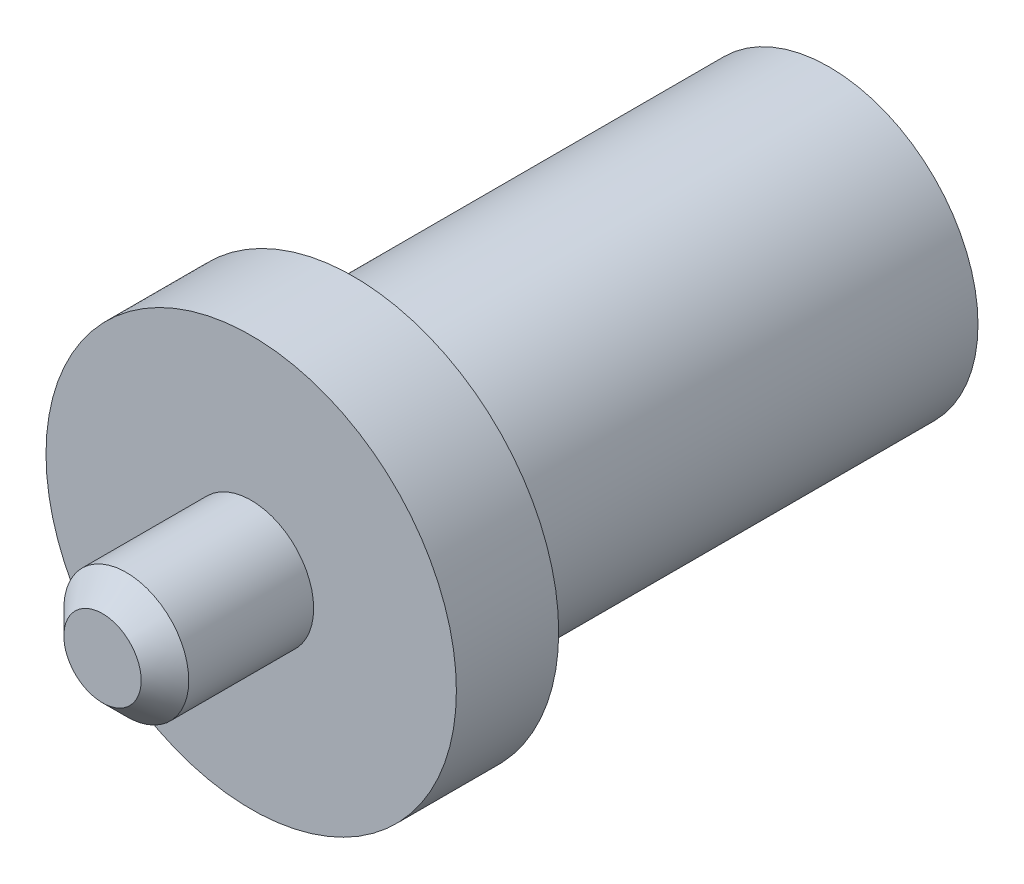
from build123d import *

# Parameters (mm, degrees)
SKETCH1_R           = 3.45
BOSS_EXTRUDE1_DEPTH = 1.72
SKETCH2_R           = 2.5
BOSS_EXTRUDE2_DEPTH = 8
SKETCH3_R           = 1.05
BOSS_EXTRUDE3_DEPTH = 2.5
CHAMFER1_SIZE       = 0.4


with BuildPart() as part:
    # Sketch1 → Boss-Extrude1 (new body)
    with BuildSketch(Plane.XY):
        Circle(SKETCH1_R)
    extrude(amount=-BOSS_EXTRUDE1_DEPTH)

    # Sketch2 → Boss-Extrude2 (add)
    with BuildSketch(Plane(origin=(0, 0, -1.72), x_dir=(-1, 0, 0), z_dir=(0, 0, -1))):
        with Locations(Location((0, 0, 0), (0, 0, 180))):
            Circle(SKETCH2_R)
    extrude(amount=BOSS_EXTRUDE2_DEPTH)

    # Sketch3 → Boss-Extrude3 (add)
    with BuildSketch(Plane.XY):
        Circle(SKETCH3_R)
    extrude(amount=BOSS_EXTRUDE3_DEPTH)

    # Chamfer1
    chamfer1_edges = [part.edges().sort_by_distance(p)[0] for p in [
        (-1.05, 0, 2.5),
    ]]
    chamfer(chamfer1_edges, length=CHAMFER1_SIZE)


solid = part.part
